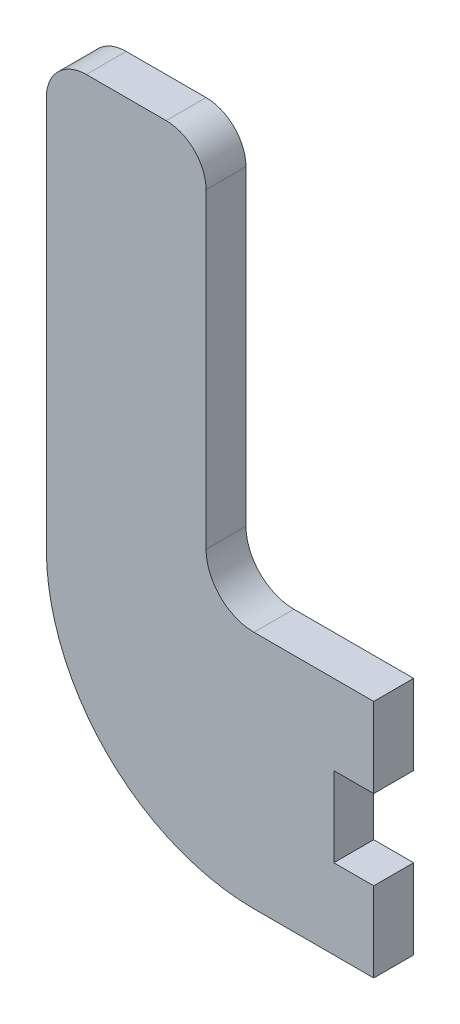
from build123d import *

# Parameters (mm, degrees)
BOSS_EXTRUDE1_DEPTH = 3.175
FILLET1_R           = 3.175


with BuildPart() as part:
    # Sketch1 → Boss-Extrude1 (new body)
    with BuildSketch(Plane.XY):
        with BuildLine():
            Line((0, 0), (3.175, 0))
            Line((3.175, 0), (3.175, 6.35))
            Line((3.175, 6.35), (0, 6.35))
            Line((0, 6.35), (0, 12.7))
            Line((0, 12.7), (3.175, 12.7))
            Line((3.175, 12.7), (3.175, 19.05))
            Line((3.175, 19.05), (0, 19.05))
            Line((0, 19.05), (-6.35, 19.05))
            ThreePointArc((-6.35, 19.05), (-9.044076836, 20.165923164), (-10.16, 22.86))
            Line((-10.16, 22.86), (-10.16, 50.8))
            Line((-10.16, 50.8), (-22.86, 50.8))
            Line((-22.86, 50.8), (-22.86, 16.51))
            ThreePointArc((-22.86, 16.51), (-18.024332957, 4.835667043), (-6.35, 0))
            Line((-6.35, 0), (0, 0))
        make_face()
    extrude(amount=BOSS_EXTRUDE1_DEPTH)

    # Fillet1
    fillet1_edges = [part.edges().sort_by_distance(p)[0] for p in [
        (-22.86, 50.8, 1.5875),
        (-10.16, 50.8, 1.5875),
    ]]
    fillet(fillet1_edges, radius=FILLET1_R)


solid = part.part
